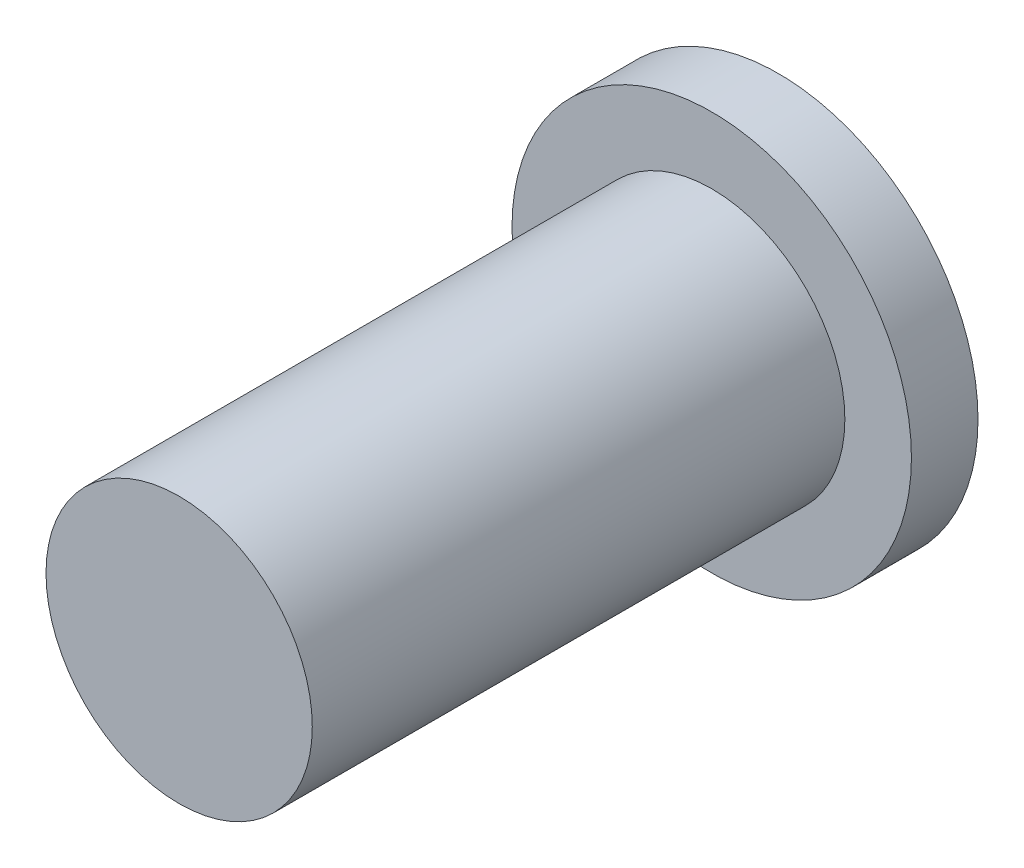
from build123d import *

# Parameters (mm, degrees)
SKETCH1_R           = 3.81
BOSS_EXTRUDE1_DEPTH = 1.27
SKETCH2_R           = 2.54
BOSS_EXTRUDE2_DEPTH = 10.16


with BuildPart() as part:
    # Sketch1 → Boss-Extrude1 (new body)
    with BuildSketch(Plane.XY):
        Circle(SKETCH1_R)
    extrude(amount=BOSS_EXTRUDE1_DEPTH)

    # Sketch2 → Boss-Extrude2 (add)
    with BuildSketch(Plane.XY.offset(1.27)):
        Circle(SKETCH2_R)
    extrude(amount=BOSS_EXTRUDE2_DEPTH)


solid = part.part
